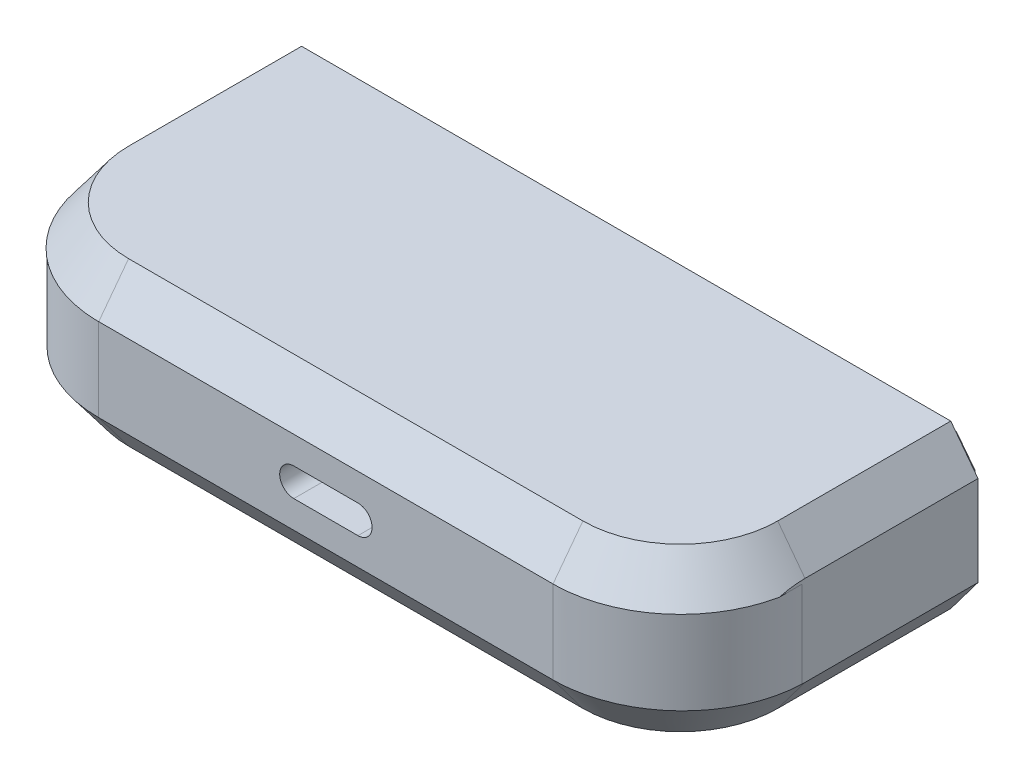
from build123d import *

# Parameters (mm, degrees)
BOSS_EXTRUDE1_DEPTH     = 15
SKETCH16_OUTSIDE_W      = 100.748
SKETCH16_OUTSIDE_H      = 75.748
CUT_EXTRUDE6_DEPTH      = 12.07
CUT_EXTRUDE6_DRAFT      = -37
BOSS_EXTRUDE5_DEPTH     = 11.339016
SKETCH19_OUTSIDE_W      = 82.556
SKETCH19_OUTSIDE_H      = 57.556
CUT_EXTRUDE7_DEPTH      = 12.07
MIRROR2_COPY_1_SKETCH_W = 100.748
MIRROR2_COPY_1_SKETCH_H = 75.748
MIRROR2_COPY_1_DEPTH    = 12.07
MIRROR2_COPY_1_DRAFT    = -37
CUT_EXTRUDE8_DEPTH      = 5
SKETCH21_W              = 65
SKETCH21_H              = 14.789798151
CUT_EXTRUDE9_DEPTH      = 42.003048923
SKETCH24_OUTSIDE_W      = 81.488
SKETCH24_OUTSIDE_H      = 31.488
CUT_EXTRUDE10_DEPTH     = 0.5
CUT_EXTRUDE11_DEPTH     = 13.5


with BuildPart() as part:
    # Sketch2 → Boss-Extrude1 (new body)
    with BuildSketch(Plane(origin=(0, 0, 0), x_dir=(1, 0, 0), z_dir=(0, 1, 0))):
        with BuildLine():
            Line((32.5, 11), (32.5, -11))
            ThreePointArc((32.5, -11), (29.863961031, -17.363961031), (23.5, -20))
            Line((23.5, -20), (-23.5, -20))
            ThreePointArc((-23.5, -20), (-29.863961031, -17.363961031), (-32.5, -11))
            Line((-32.5, -11), (-32.5, 11))
            ThreePointArc((-32.5, 11), (-29.863961031, 17.363961031), (-23.5, 20))
            Line((-23.5, 20), (23.5, 20))
            ThreePointArc((23.5, 20), (29.863961031, 17.363961031), (32.5, 11))
        make_face()
    extrude(amount=BOSS_EXTRUDE1_DEPTH)


with BuildPart() as cut_extrude6_tool:
    # Sketch16 outside → Cut-Extrude6 (with draft: the straight prism first)
    with BuildSketch(Plane(origin=(0, 15, 0), x_dir=(1, 0, 0), z_dir=(0, 1, 0))):
        Rectangle(SKETCH16_OUTSIDE_W, SKETCH16_OUTSIDE_H)
        with BuildLine():
            ThreePointArc((20.98434934, -17.241250967), (27.348310371, -14.605211998), (29.98434934, -8.241250967))
            Line((29.98434934, -8.241250967), (29.98434934, 8.241250967))
            ThreePointArc((29.98434934, 8.241250967), (27.348310371, 14.605211998), (20.98434934, 17.241250967))
            Line((20.98434934, 17.241250967), (-20.98434934, 17.241250967))
            ThreePointArc((-20.98434934, 17.241250967), (-27.348310371, 14.605211998), (-29.98434934, 8.241250967))
            Line((-29.98434934, 8.241250967), (-29.98434934, -8.241250967))
            ThreePointArc((-29.98434934, -8.241250967), (-27.348310371, -14.605211998), (-20.98434934, -17.241250967))
            Line((-20.98434934, -17.241250967), (20.98434934, -17.241250967))
        make_face(mode=Mode.SUBTRACT)
    extrude(amount=-CUT_EXTRUDE6_DEPTH)
    # Cut-Extrude6: the draft: its side faces are tilted about the plane it starts from
    cut_extrude6_sides = [cut_extrude6_tool.faces().sort_by_distance(p)[0] for p in [
        (0, 8.965, 37.874),
        (50.374, 8.965, 0),
        (0, 8.965, -37.874),
        (-50.374, 8.965, 0),
        (0, 8.965, 17.241250967),
        (-27.348310371, 8.965, 14.605211998),
        (-29.98434934, 8.965, 0),
        (-27.348310371, 8.965, -14.605211998),
        (0, 8.965, -17.241250967),
        (27.348310371, 8.965, -14.605211998),
        (29.98434934, 8.965, 0),
        (27.348310371, 8.965, 14.605211998),
    ]]
    draft(cut_extrude6_sides, Plane(origin=(0, 15, 0), x_dir=(1, 0, 0), z_dir=(0, 1, 0)), CUT_EXTRUDE6_DRAFT)


with BuildPart() as part_1:
    add(part.part)

    # Cut-Extrude6: cut by cut_extrude6_tool
    add(cut_extrude6_tool.part, mode=Mode.SUBTRACT)

    # Sketch17 → Boss-Extrude5 (add)
    with BuildSketch(Plane.XZ):
        with BuildLine():
            Line((23.5, -20), (-23.5, -20))
            ThreePointArc((-23.5, -20), (-29.863961031, -17.363961031), (-32.5, -11))
            Line((-32.5, -11), (-32.5, 11))
            ThreePointArc((-32.5, 11), (-29.863961031, 17.363961031), (-23.5, 20))
            Line((-23.5, 20), (23.5, 20))
            ThreePointArc((23.5, 20), (29.863961031, 17.363961031), (32.5, 11))
            Line((32.5, 11), (32.5, -11))
            ThreePointArc((32.5, -11), (29.863961031, -17.363961031), (23.5, -20))
        make_face()
    extrude(amount=-BOSS_EXTRUDE5_DEPTH)

    # Sketch19 outside → Cut-Extrude7 (cut)
    with BuildSketch(Plane(origin=(0, 11.339016382, 0), x_dir=(1, 0, 0), z_dir=(0, 1, 0))):
        Rectangle(SKETCH19_OUTSIDE_W, SKETCH19_OUTSIDE_H)
        with BuildLine():
            Line((21, -20), (-21, -20))
            ThreePointArc((-21, -20), (-29.131727984, -16.631727984), (-32.5, -8.5))
            Line((-32.5, -8.5), (-32.5, 8.5))
            ThreePointArc((-32.5, 8.5), (-29.131727984, 16.631727984), (-21, 20))
            Line((-21, 20), (21, 20))
            ThreePointArc((21, 20), (29.131727984, 16.631727984), (32.5, 8.5))
            Line((32.5, 8.5), (32.5, -8.5))
            ThreePointArc((32.5, -8.5), (29.131727984, -16.631727984), (21, -20))
        make_face(mode=Mode.SUBTRACT)
    extrude(amount=-CUT_EXTRUDE7_DEPTH, mode=Mode.SUBTRACT)


with BuildPart() as mirror2_copy_1_tool:
    # Mirror2 copy 1 sketch → Mirror2 copy 1 (with draft: the straight prism first)
    with BuildSketch(Plane.XZ):
        Rectangle(MIRROR2_COPY_1_SKETCH_W, MIRROR2_COPY_1_SKETCH_H)
        with BuildLine():
            ThreePointArc((20.98434934, 17.241250967), (27.348310371, 14.605211998), (29.98434934, 8.241250967))
            Line((29.98434934, 8.241250967), (29.98434934, -8.241250967))
            ThreePointArc((29.98434934, -8.241250967), (27.348310371, -14.605211998), (20.98434934, -17.241250967))
            Line((20.98434934, -17.241250967), (-20.98434934, -17.241250967))
            ThreePointArc((-20.98434934, -17.241250967), (-27.348310371, -14.605211998), (-29.98434934, -8.241250967))
            Line((-29.98434934, -8.241250967), (-29.98434934, 8.241250967))
            ThreePointArc((-29.98434934, 8.241250967), (-27.348310371, 14.605211998), (-20.98434934, 17.241250967))
            Line((-20.98434934, 17.241250967), (20.98434934, 17.241250967))
        make_face(mode=Mode.SUBTRACT)
    extrude(amount=-MIRROR2_COPY_1_DEPTH)
    # Mirror2 copy 1: the draft: its side faces are tilted about the plane it starts from
    mirror2_copy_1_sides = [mirror2_copy_1_tool.faces().sort_by_distance(p)[0] for p in [
        (0, 6.035, 37.874),
        (50.374, 6.035, 0),
        (0, 6.035, -37.874),
        (-50.374, 6.035, 0),
        (0, 6.035, 17.241250967),
        (-27.348310371, 6.035, 14.605211998),
        (-29.98434934, 6.035, 0),
        (-27.348310371, 6.035, -14.605211998),
        (0, 6.035, -17.241250967),
        (27.348310371, 6.035, -14.605211998),
        (29.98434934, 6.035, 0),
        (27.348310371, 6.035, 14.605211998),
    ]]
    draft(mirror2_copy_1_sides, Plane.XZ, MIRROR2_COPY_1_DRAFT)


with BuildPart() as part_2:
    add(part_1.part)

    # Mirror2 copy 1: cut by mirror2_copy_1_tool
    add(mirror2_copy_1_tool.part, mode=Mode.SUBTRACT)

    # Sketch20 → Cut-Extrude8 (cut)
    with BuildSketch(Plane.XY.offset(20)):
        with BuildLine():
            Line((-2.962646441, 8.804975218), (2.962646441, 8.804975218))
            ThreePointArc((2.962646441, 8.804975218), (4.267614748, 7.500006911), (2.962646441, 6.195038604))
            Line((2.962646441, 6.195038604), (-2.962646441, 6.195038604))
            ThreePointArc((-2.962646441, 6.195038604), (-4.267614748, 7.500006911), (-2.962646441, 8.804975218))
        make_face()
    extrude(amount=-CUT_EXTRUDE8_DEPTH, mode=Mode.SUBTRACT)

    # Sketch21 → Cut-Extrude9 (cut, through all)
    with BuildSketch(Plane(origin=(0, 15, 0), x_dir=(1, 0, 0), z_dir=(0, 1, 0))):
        with Locations((0, 15.636150043)):
            Rectangle(SKETCH21_W, SKETCH21_H)
    extrude(amount=-CUT_EXTRUDE9_DEPTH, mode=Mode.SUBTRACT)

    # Sketch24 outside → Cut-Extrude10 (cut)
    with BuildSketch(Plane(origin=(0, 0, -8.241250967), x_dir=(-1, 0, 0), z_dir=(0, 0, -1))):
        with Locations((0, 7.5)):
            Rectangle(SKETCH24_OUTSIDE_W, SKETCH24_OUTSIDE_H)
        Polygon((-29.98434934, 13.945961387), (29.98434934, 13.945961387), (31.740486343, 11.661618818), (31.740486343, 3.338381182), (29.98434934, 1.054038613), (-29.98434934, 1.054038613), (-31.740486343, 3.338381182), (-31.740486343, 11.661618818), align=None, mode=Mode.SUBTRACT)
    extrude(amount=-CUT_EXTRUDE10_DEPTH, mode=Mode.SUBTRACT)

    # Sketch26 → Cut-Extrude11 (cut)
    with BuildSketch(Plane(origin=(0, 0, -8.241250967), x_dir=(-1, 0, 0), z_dir=(0, 0, -1))):
        with BuildLine():
            add(Edge.make_bspline(
                [(-25.932806516, 12.228762985), (-26.253217146, 12.209752493), (-27.822093228, 11.780540758), (-29.216428948, 9.619463608), (-28.730620115, 6.674234407), (-26.709085002, 4.834547367), (-23.492982534, 3.503984265), (-19.243103208, 3.105305441), (-14.241593476, 4.549770855), (-12.410415887, 9.165041374), (-14.368157257, 12.695434028), (-18.193683135, 13.634880641), (-20.898264257, 11.174794227), (-23.753569207, 11.728629255), (-25.362496316, 12.262600432), (-25.932806516, 12.228762985)],
                knots=[0, 0, 0, 0, 0.023599079, 0.114503628, 0.150250039, 0.234094255, 0.295688311, 0.402182476, 0.540872925, 0.636631848, 0.716932026, 0.804894784, 0.879535481, 0.957995165, 1, 1, 1, 1], degree=3))
        make_face()
    extrude(amount=-CUT_EXTRUDE11_DEPTH, mode=Mode.SUBTRACT)


solid = part_2.part
